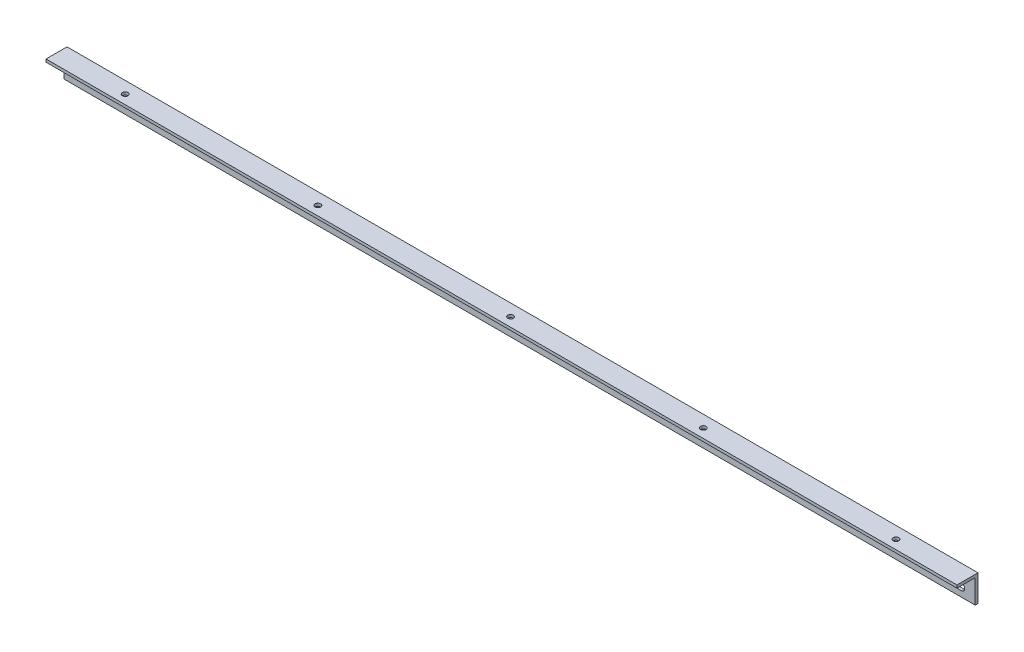
from build123d import *

# Parameters (mm, degrees)
BOSS_EXTRUDE1_DEPTH = 650
CUT_EXTRUDE1_DEPTH  = 2
SKETCH4_R           = 2
CUT_EXTRUDE2_DEPTH  = 2


with BuildPart() as part:
    # Sketch1 → Boss-Extrude1 (new body)
    with BuildSketch(Plane(origin=(0, 0, 0), x_dir=(0, 0, -1), z_dir=(1, 0, 0))):
        Polygon((0, 0), (-15, 0), (-15, -2), (-2, -2), (-2, -19), (0, -19), align=None)
    extrude(amount=BOSS_EXTRUDE1_DEPTH)

    # Sketch3 → Cut-Extrude1 (cut)
    with BuildSketch(Plane(origin=(0, 0, 0), x_dir=(-1, 0, 0), z_dir=(0, 0, -1))):
        with BuildLine():
            Line((-640, -10), (-10, -10))
            ThreePointArc((-10, -10), (-7.5, -12.5), (-10, -15))
            Line((-10, -15), (-640, -15))
            ThreePointArc((-640, -15), (-642.5, -12.5), (-640, -10))
        make_face()
    extrude(amount=-CUT_EXTRUDE1_DEPTH, mode=Mode.SUBTRACT)

    # Sketch4 → Cut-Extrude2 (cut)
    with BuildSketch(Plane.XZ.offset(2)):
        with Locations(Location((325, 8.5, 0), (0, 0, 270))):
            Circle(SKETCH4_R)
        with Locations(Location((187.5, 8.5, 0), (0, 0, 270))):
            Circle(SKETCH4_R)
        with Locations(Location((50, 8.5, 0), (0, 0, 270))):
            Circle(SKETCH4_R)
        with Locations(Location((462.5, 8.5, 0), (0, 0, 270))):
            Circle(SKETCH4_R)
        with Locations(Location((600, 8.5, 0), (0, 0, 270))):
            Circle(SKETCH4_R)
    extrude(amount=-CUT_EXTRUDE2_DEPTH, mode=Mode.SUBTRACT)


solid = part.part
